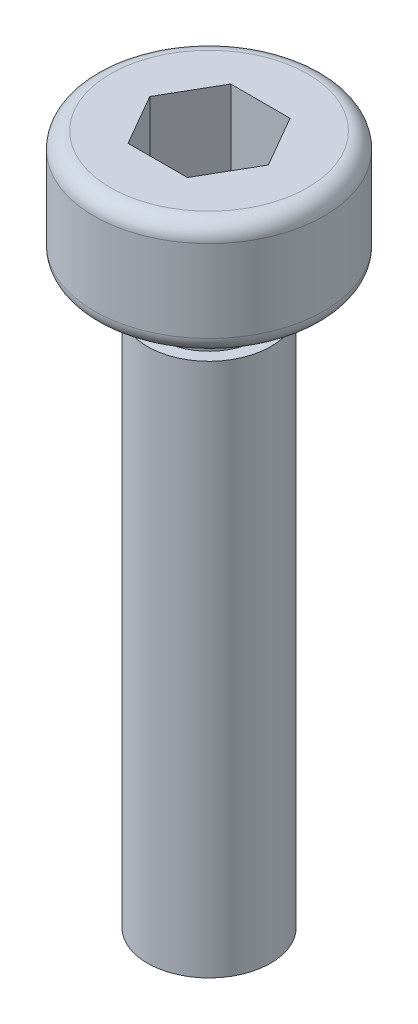
from build123d import *

# Parameters (mm, degrees)
CUT_EXTRUDE_1_DEPTH = 2


with BuildPart() as part:
    # 草图1 → 旋转1 (revolve)
    with BuildSketch(Plane.XY, mode=Mode.PRIVATE) as revolve_1_sk:
        with BuildLine():
            Line((0, 16.8), (-2.4, 16.8))
            ThreePointArc((-2.4, 16.8), (-2.682842712, 16.682842712), (-2.8, 16.4))
            Line((-2.8, 16.4), (-2.8, 14.4))
            ThreePointArc((-2.8, 14.4), (-2.682842712, 14.117157288), (-2.4, 14))
            Line((-2.4, 14), (-1.2, 14))
            Line((-1.2, 14), (-1.2, 13))
            Line((-1.2, 13), (-1.5, 13))
            Line((-1.5, 13), (-1.5, 0))
            Line((-1.5, 0), (0, 0))
            Line((0, 0), (0, 16.8))
        make_face()
    revolve(revolve_1_sk.sketch.rotate(Axis((0, 0, 0), (0, 1, 0)), 270), axis=Axis((0, 0, 0), (0, 1, 0)))

    # 草图2 → 切除-拉伸1 (cut)
    with BuildSketch(Plane(origin=(0, 16.8, 0), x_dir=(1, 0, 0), z_dir=(0, 1, 0))):
        Polygon((-0.721687836, 1.25), (-1.443375673, 0), (-0.721687836, -1.25), (0.721687836, -1.25), (1.443375673, 0), (0.721687836, 1.25), align=None)
    extrude(amount=-CUT_EXTRUDE_1_DEPTH, mode=Mode.SUBTRACT)


solid = part.part
